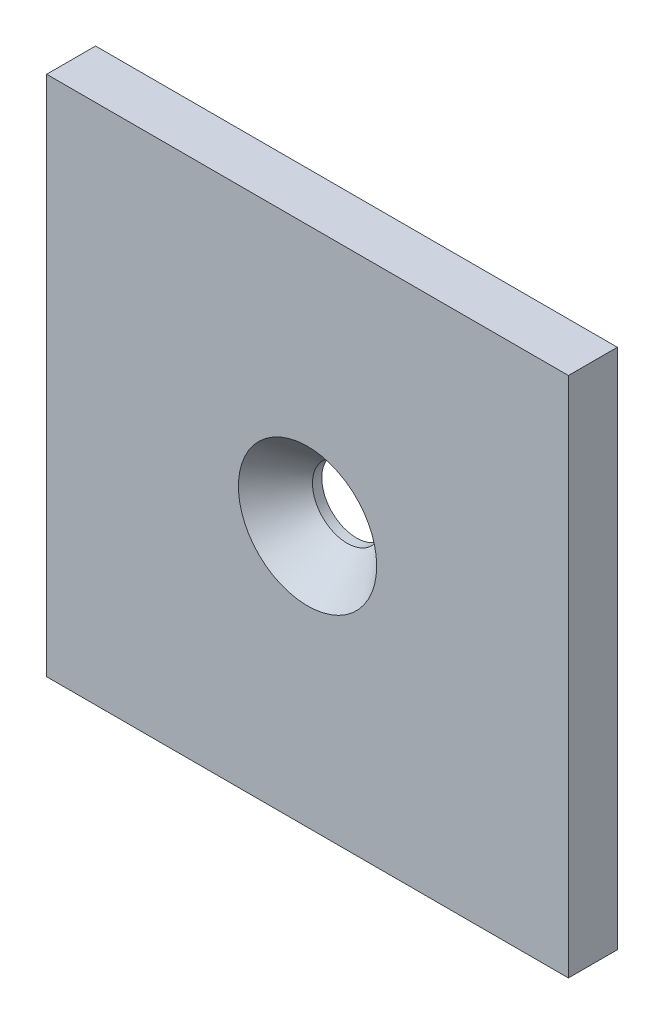
from build123d import *

# Parameters (mm, degrees)
SKETCH1_W           = 50.8
SKETCH1_H           = 50.8
BOSS_EXTRUDE1_DEPTH = 4.7625


with BuildPart() as part:
    # Sketch1 → Boss-Extrude1 (new body)
    with BuildSketch(Plane.XY):
        with Locations((25.4, -25.4)):
            Rectangle(SKETCH1_W, SKETCH1_H)
    extrude(amount=BOSS_EXTRUDE1_DEPTH)

    # Sketch4 → CSK for 1/4 Flat Head Machine Screw (100)1 (revolve, cut)
    with BuildSketch(Plane(origin=(25.4, -25.4, 4.7625), x_dir=(0, -1, 0), z_dir=(1, 0, 0))):
        Polygon((0, 0), (0, 4.7625), (3.3782, 4.7625), (3.3782, 3.856955196), (6.731, 0), align=None)
    revolve(axis=Axis((25.4, -25.4, 11.1125), (0, 0, -1)), mode=Mode.SUBTRACT)


solid = part.part
